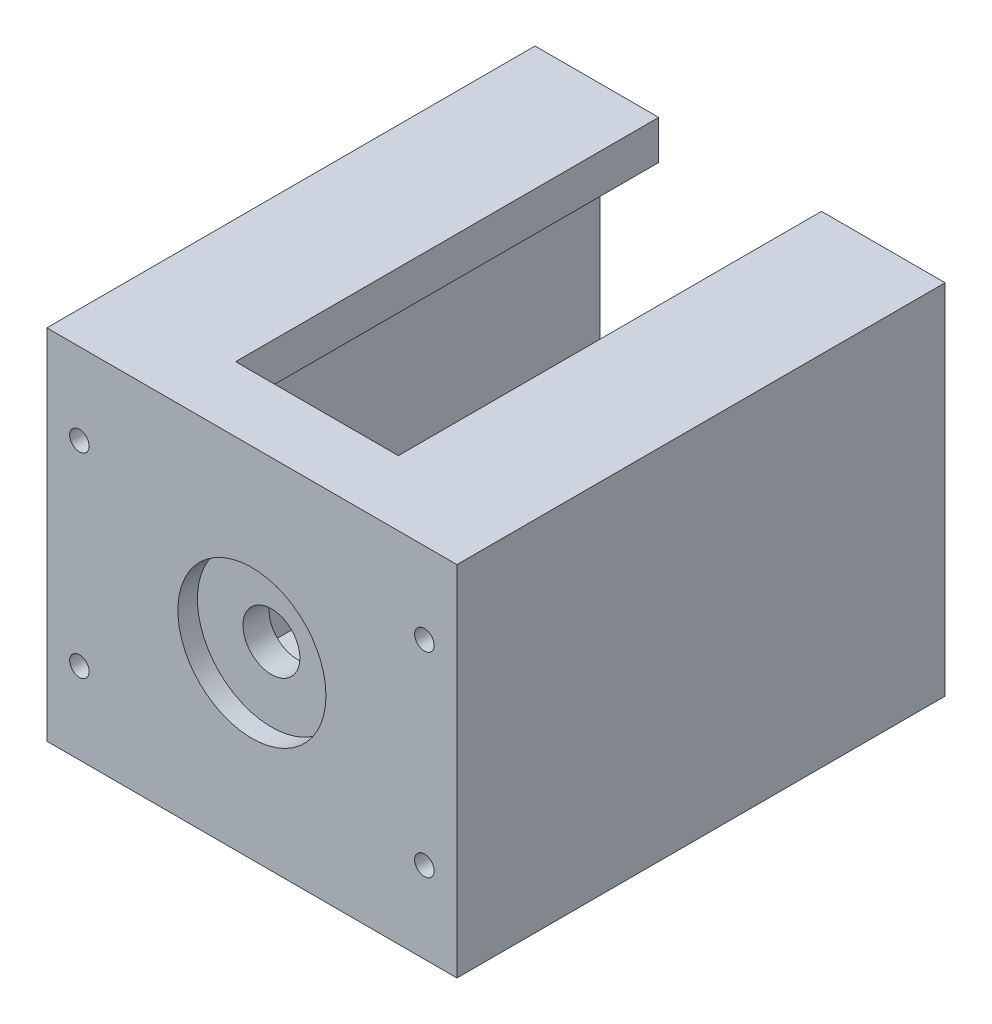
from build123d import *

# Parameters (mm, degrees)
SKETCH1_7_W         = 63
SKETCH1_7_H         = 55
SKETCH1_7_R         = 1.5
SKETCH1_7_R_2       = 11.375
BOSS_EXTRUDE3_DEPTH = 10
BOSS_EXTRUDE4_START = -65
SKETCH1_8_W         = 63
SKETCH1_8_H         = 55
SKETCH1_8_R         = 1.5
SKETCH1_8_W_2       = 43
SKETCH1_8_H_2       = 43
BOSS_EXTRUDE4_DEPTH = 65
SKETCH4_W           = 12.5
SKETCH4_H           = 65
CUT_EXTRUDE5_DEPTH  = 6
SKETCH1_15_R        = 11.375
SKETCH1_15_R_2      = 4.375
BOSS_EXTRUDE5_DEPTH = 7
SKETCH1_16_R        = 11.375
SKETCH1_16_R_2      = 4.375
CUT_EXTRUDE7_DEPTH  = 3


with BuildPart() as part:
    # Sketch1<7> → Boss-Extrude3 (new body)
    with BuildSketch(Plane.XY):
        with Locations((21.5, 21.5)):
            Rectangle(SKETCH1_7_W, SKETCH1_7_H)
        with Locations((-5, 36.5)):
            Circle(SKETCH1_7_R, mode=Mode.SUBTRACT)
        with Locations((-5, 6.5)):
            Circle(SKETCH1_7_R, mode=Mode.SUBTRACT)
        with Locations((48, 6.5)):
            Circle(SKETCH1_7_R, mode=Mode.SUBTRACT)
        with Locations((48, 36.5)):
            Circle(SKETCH1_7_R, mode=Mode.SUBTRACT)
        with Locations((21.5, 21.5)):
            Circle(SKETCH1_7_R_2, mode=Mode.SUBTRACT)
    extrude(amount=BOSS_EXTRUDE3_DEPTH)

    # Sketch1<8> → Boss-Extrude4 (add)
    with BuildSketch(Plane.XY.offset(BOSS_EXTRUDE4_START)):
        with Locations((21.5, 21.5)):
            Rectangle(SKETCH1_8_W, SKETCH1_8_H)
        with Locations((48, 6.5)):
            Circle(SKETCH1_8_R, mode=Mode.SUBTRACT)
        with Locations((-5, 6.5)):
            Circle(SKETCH1_8_R, mode=Mode.SUBTRACT)
        with Locations((-5, 36.5)):
            Circle(SKETCH1_8_R, mode=Mode.SUBTRACT)
        with Locations((48, 36.5)):
            Circle(SKETCH1_8_R, mode=Mode.SUBTRACT)
        with Locations((21.5, 21.5)):
            Rectangle(SKETCH1_8_W_2, SKETCH1_8_H_2, mode=Mode.SUBTRACT)
    extrude(amount=BOSS_EXTRUDE4_DEPTH)

    # Sketch4 → Cut-Extrude5 (cut)
    with BuildSketch(Plane.XZ.offset(-43)):
        with Locations((27.75, -32.5)):
            Rectangle(SKETCH4_W, SKETCH4_H)
        with Locations((15.25, -32.5)):
            Rectangle(SKETCH4_W, SKETCH4_H)
    extrude(amount=-CUT_EXTRUDE5_DEPTH, mode=Mode.SUBTRACT)

    # Sketch1<15> → Boss-Extrude5 (add)
    with BuildSketch(Plane.XY):
        with Locations((21.5, 21.5)):
            Circle(SKETCH1_15_R)
        with Locations((21.5, 21.5)):
            Circle(SKETCH1_15_R_2, mode=Mode.SUBTRACT)
    extrude(amount=BOSS_EXTRUDE5_DEPTH)

    # Sketch1<16> → Cut-Extrude7 (cut)
    with BuildSketch(Plane.XY):
        with Locations((21.5, 21.5)):
            Circle(SKETCH1_16_R)
        with Locations((21.5, 21.5)):
            Circle(SKETCH1_16_R_2, mode=Mode.SUBTRACT)
    extrude(amount=CUT_EXTRUDE7_DEPTH, mode=Mode.SUBTRACT)


solid = part.part
